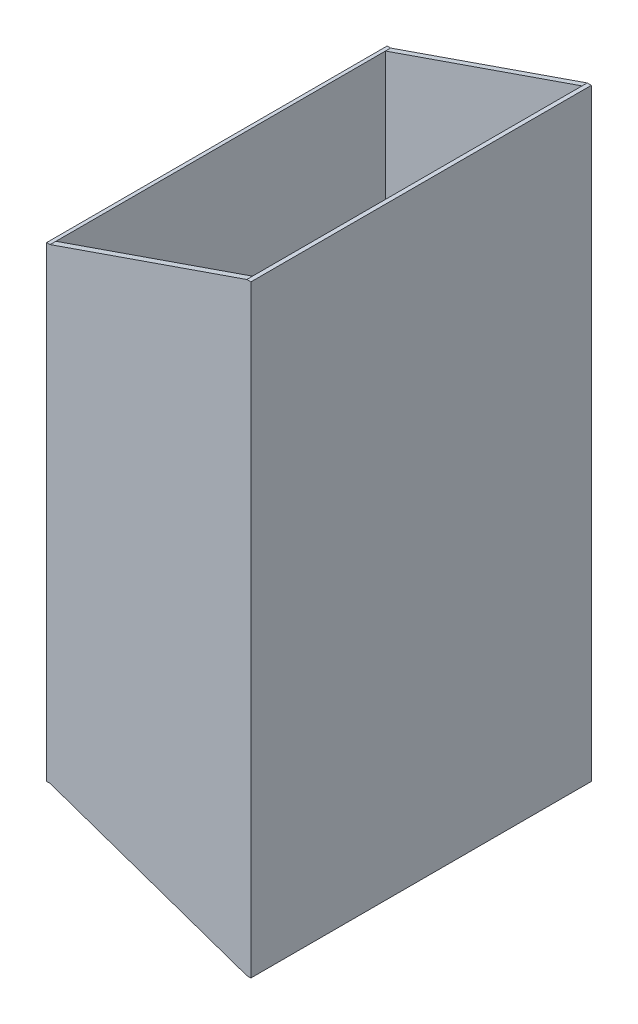
from build123d import *

# Parameters (mm, degrees)
SKETCH1_W           = 15
SKETCH1_H           = 44.271951098
BOSS_EXTRUDE4_DEPTH = 25
SKETCH4_W           = 14.437791502
SKETCH4_H           = 24.200488612
CUT_EXTRUDE4_DEPTH  = 54.009486453
CUT_EXTRUDE5_DEPTH  = 54.009486453
CUT_EXTRUDE6_DEPTH  = 54.009486453
SKETCH7_W           = 0.258481213
SKETCH7_H           = 5
CUT_EXTRUDE7_DEPTH  = 54.009486453
SKETCH10_W          = 0.258481213
SKETCH10_H          = 5
CUT_EXTRUDE8_DEPTH  = 54.009486453


with BuildPart() as part:
    # Sketch1 → Boss-Extrude4 (new body)
    with BuildSketch(Plane.XY):
        with Locations((7.5, 22.135975549)):
            Rectangle(SKETCH1_W, SKETCH1_H)
    extrude(amount=BOSS_EXTRUDE4_DEPTH)

    # Sketch4 → Cut-Extrude4 (cut, through all)
    with BuildSketch(Plane(origin=(0, 44.271951098, 0), x_dir=(1, 0, 0), z_dir=(0, 1, 0))):
        with Locations((7.477376964, -12.479096566)):
            Rectangle(SKETCH4_W, SKETCH4_H)
    extrude(amount=-CUT_EXTRUDE4_DEPTH, mode=Mode.SUBTRACT)

    # Sketch5 → Cut-Extrude5 (cut, through all)
    with BuildSketch(Plane(origin=(0, 0, 0), x_dir=(-1, 0, 0), z_dir=(0, 0, -1))):
        Polygon((-14.696272715, 44.271951098), (-0.258481213, 44.271951098), (-0.258481213, 39.271951098), align=None)
    extrude(amount=-CUT_EXTRUDE5_DEPTH, mode=Mode.SUBTRACT)

    # Sketch6 → Cut-Extrude6 (cut, through all)
    with BuildSketch(Plane(origin=(0, 0, 0), x_dir=(-1, 0, 0), z_dir=(0, 0, -1))):
        Polygon((-0.258481213, 0), (-0.258481213, 5), (-14.696272715, 0), align=None)
    extrude(amount=-CUT_EXTRUDE6_DEPTH, mode=Mode.SUBTRACT)

    # Sketch7 → Cut-Extrude7 (cut, through all)
    with BuildSketch(Plane(origin=(0, 0, 0), x_dir=(-1, 0, 0), z_dir=(0, 0, -1))):
        with Locations((-0.129240607, 41.771951098)):
            Rectangle(SKETCH7_W, SKETCH7_H)
    extrude(amount=-CUT_EXTRUDE7_DEPTH, mode=Mode.SUBTRACT)

    # Sketch10 → Cut-Extrude8 (cut, through all)
    with BuildSketch(Plane(origin=(0, 0, 0), x_dir=(-1, 0, 0), z_dir=(0, 0, -1))):
        with Locations((-0.129240607, 2.5)):
            Rectangle(SKETCH10_W, SKETCH10_H)
    extrude(amount=-CUT_EXTRUDE8_DEPTH, mode=Mode.SUBTRACT)


solid = part.part
